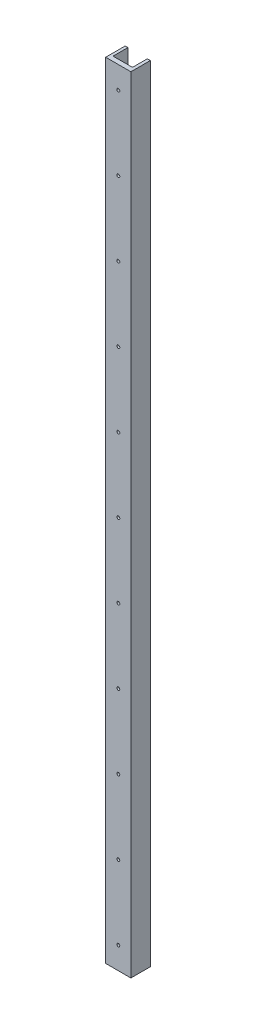
from build123d import *

# Parameters (mm, degrees)
SKETCH1_W                                       = 43.18
SKETCH1_H                                       = 1346.2
BOSS_EXTRUDE1_DEPTH                             = 33.3248
SKETCH9_W                                       = 33.3375
SKETCH9_H                                       = 33.121582444
CUT_EXTRUDE1_DEPTH                              = 1348.304529308
CSK_FOR_10_FLAT_HEAD_MACHINE_SCREW3_D           = 5.1054
CSK_FOR_10_FLAT_HEAD_MACHINE_SCREW3_DEPTH       = 76.2
CSK_FOR_10_FLAT_HEAD_MACHINE_SCREW3_CSINK_D     = 10.2206044
CSK_FOR_10_FLAT_HEAD_MACHINE_SCREW3_CSINK_ANGLE = 82
CSK_FOR_10_FLAT_HEAD_MACHINE_SCREW3_TIP         = 1.533816902


with BuildPart() as part:
    # Sketch1 → Boss-Extrude1 (new body)
    with BuildSketch(Plane.XY):
        with Locations((-21.59, -548.180033686)):
            Rectangle(SKETCH1_W, SKETCH1_H)
    extrude(amount=BOSS_EXTRUDE1_DEPTH)

    # Sketch9 → Cut-Extrude1 (cut, through all)
    with BuildSketch(Plane(origin=(0, 124.919966314, 0), x_dir=(1, 0, 0), z_dir=(0, 1, 0))):
        with Locations((-21.81225, -8.826508778)):
            Rectangle(SKETCH9_W, SKETCH9_H)
    extrude(amount=-CUT_EXTRUDE1_DEPTH, mode=Mode.SUBTRACT)

    # CSK for #10 Flat Head Machine Screw3
    with Locations(Plane(origin=(0, 0, 25.3873), x_dir=(-1, 0, 0), z_dir=(0, 0, -1))):
        with Locations((21.59, -1183.180033686), (21.59, -1056.180033686), (21.59, -929.180033686), (21.59, -802.180033686), (21.59, -675.180033686), (21.59, -548.180033686), (21.59, -421.180033686), (21.59, -294.180033686), (21.59, -167.180033686), (21.59, -40.180033686), (21.59, 86.819966314)):
            CounterSinkHole(CSK_FOR_10_FLAT_HEAD_MACHINE_SCREW3_D / 2, CSK_FOR_10_FLAT_HEAD_MACHINE_SCREW3_CSINK_D / 2, depth=CSK_FOR_10_FLAT_HEAD_MACHINE_SCREW3_DEPTH, counter_sink_angle=CSK_FOR_10_FLAT_HEAD_MACHINE_SCREW3_CSINK_ANGLE)
            with Locations((0, 0, -(CSK_FOR_10_FLAT_HEAD_MACHINE_SCREW3_DEPTH + CSK_FOR_10_FLAT_HEAD_MACHINE_SCREW3_TIP / 2))):  # 118° drill point
                Cone(0, CSK_FOR_10_FLAT_HEAD_MACHINE_SCREW3_D / 2, CSK_FOR_10_FLAT_HEAD_MACHINE_SCREW3_TIP, mode=Mode.SUBTRACT)


solid = part.part
